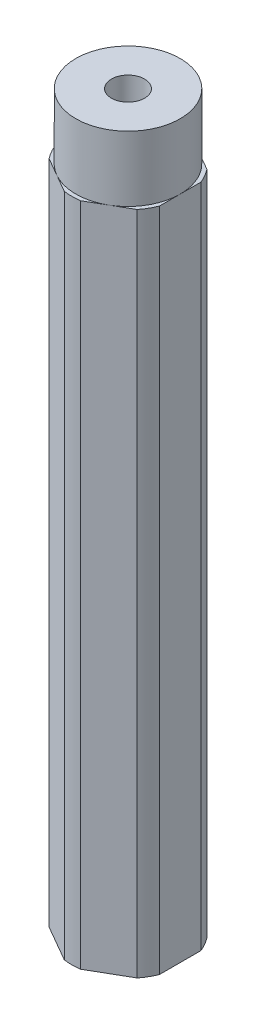
from build123d import *

# Parameters (mm, degrees)
BOSS_EXTRUDE1_DEPTH        = 40.48125
SKETCH3_R                  = 6.35
BOSS_EXTRUDE2_DEPTH        = 7.9375
F_10_32_TAPPED_HOLE1_D     = 4.0386
F_10_32_TAPPED_HOLE1_DEPTH = 12.02944
F_10_32_TAPPED_HOLE1_TIP   = 1.213317848
SKETCH2_R                  = 2.0193
CUT_EXTRUDE1_DEPTH         = 90.388013306


with BuildPart() as part:
    # Sketch1 → Boss-Extrude1 (new, symmetric)
    with BuildSketch(Plane(origin=(0, 0, 0), x_dir=(1, 0, 0), z_dir=(0, 1, 0))):
        with BuildLine():
            ThreePointArc((0.990636919, 6.760403927), (0, 6.8326), (-0.990636919, 6.760403927))
            Line((-0.990636919, 6.760403927), (-5.359363081, 4.238118701))
            ThreePointArc((-5.359363081, 4.238118701), (-5.917205174, 3.4163), (-6.35, 2.522285226))
            Line((-6.35, 2.522285226), (-6.35, -2.522285226))
            ThreePointArc((-6.35, -2.522285226), (-5.917205174, -3.4163), (-5.359363081, -4.238118701))
            Line((-5.359363081, -4.238118701), (-0.990636919, -6.760403927))
            ThreePointArc((-0.990636919, -6.760403927), (0, -6.8326), (0.990636919, -6.760403927))
            Line((0.990636919, -6.760403927), (5.359363081, -4.238118701))
            ThreePointArc((5.359363081, -4.238118701), (5.917205174, -3.4163), (6.35, -2.522285226))
            Line((6.35, -2.522285226), (6.35, 2.522285226))
            ThreePointArc((6.35, 2.522285226), (5.917205174, 3.4163), (5.359363081, 4.238118701))
            Line((5.359363081, 4.238118701), (0.990636919, 6.760403927))
        make_face()
    extrude(amount=BOSS_EXTRUDE1_DEPTH, both=True)

    # Sketch3 → Boss-Extrude2 (add)
    with BuildSketch(Plane(origin=(0, 40.48125, 0), x_dir=(1, 0, 0), z_dir=(0, 1, 0))):
        with Locations(Location((0, 0, 0), (0, 0, 60))):
            Circle(SKETCH3_R)
    extrude(amount=BOSS_EXTRUDE2_DEPTH)

    # #10-32 Tapped Hole1
    with Locations(Plane(origin=(0, -40.48125, 0), x_dir=(-1, 0, 0), z_dir=(0, -1, 0))):
        with Locations((0, 0)):
            Hole(F_10_32_TAPPED_HOLE1_D / 2, depth=F_10_32_TAPPED_HOLE1_DEPTH)
            with Locations((0, 0, -(F_10_32_TAPPED_HOLE1_DEPTH + F_10_32_TAPPED_HOLE1_TIP / 2))):  # 118° drill point
                Cone(0, F_10_32_TAPPED_HOLE1_D / 2, F_10_32_TAPPED_HOLE1_TIP, mode=Mode.SUBTRACT)

    # Sketch2 → Cut-Extrude1 (cut, through all)
    with BuildSketch(Plane(origin=(0, -40.48125, 0), x_dir=(1, 0, 0), z_dir=(0, 1, 0))):
        with Locations(Location((0, 0, 0), (0, 0, 90))):
            Circle(SKETCH2_R)
    extrude(amount=CUT_EXTRUDE1_DEPTH, mode=Mode.SUBTRACT)


solid = part.part
